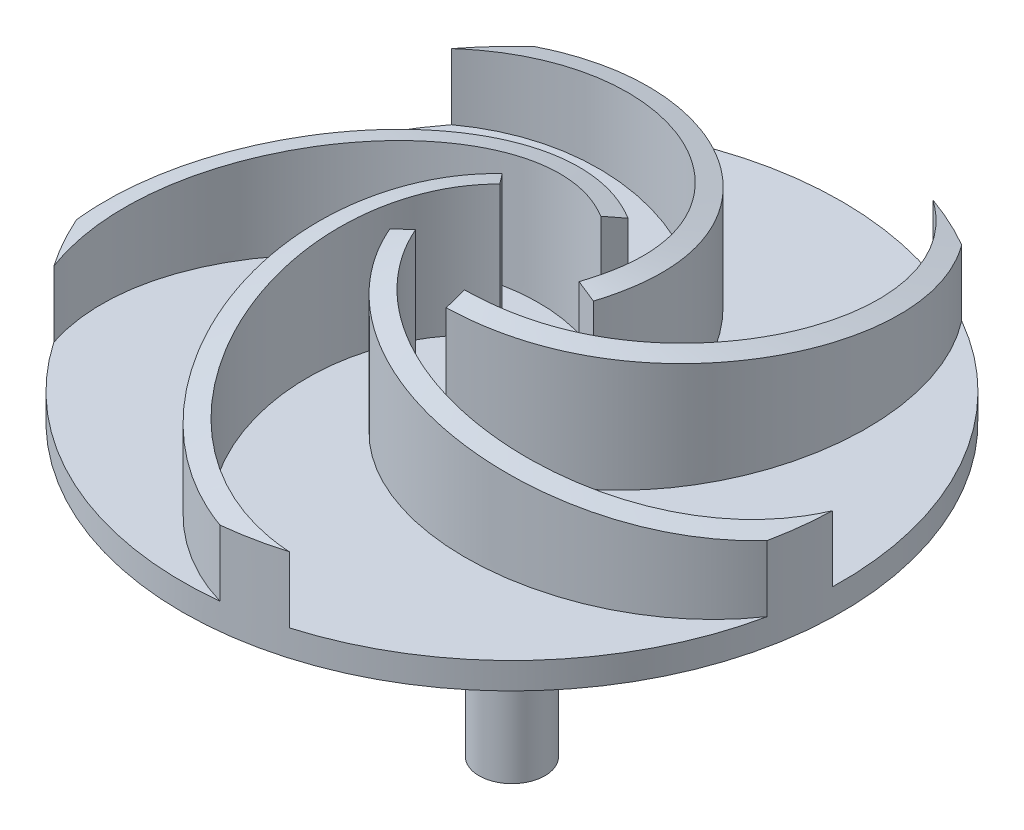
from build123d import *
from build123d.topology import SkipClean

# Parameters (mm, degrees)
SKETCH1_R           = 25
BOSS_EXTRUDE1_DEPTH = 2
BOSS_EXTRUDE3_DEPTH = 11
CIRPATTERN2_COUNT   = 5
SKETCH8_R           = 3
BOSS_EXTRUDE4_DEPTH = 22


with BuildPart() as part:
    # Sketch1 → Boss-Extrude1 (new body)
    with BuildSketch(Plane(origin=(0, 0, 0), x_dir=(1, 0, 0), z_dir=(0, 1, 0))):
        with Locations(Location((0, 0, 0), (0, 0, 270))):
            Circle(SKETCH1_R)
    extrude(amount=BOSS_EXTRUDE1_DEPTH)

    # Sketch6 → Boss-Extrude3 (add)
    with SkipClean():  # the faces are left unmerged after this step: merging them gives an invalid solid
        with BuildSketch(Plane(origin=(0, 2, 0), x_dir=(1, 0, 0), z_dir=(0, 1, 0))):
            with BuildLine():
                Line((-5.749328812, -3.514472379), (-4.357862857, -2.954273756))
                add(Edge.make_bspline(
                    [(24.990911261, -0.6740581), (24.887127665, -0.995867182), (24.628566718, -1.71005287), (23.985595049, -3.118765197), (22.927284176, -4.807175828), (21.362285482, -6.562232424), (18.938714489, -8.542099357), (15.390420708, -10.325722821), (10.688001964, -11.310980176), (5.945767318, -11.102441479), (2.299064528, -9.918635861), (-0.243718056, -8.363779173), (-1.919950701, -6.893472831), (-3.091637326, -5.406975724), (-3.870057013, -4.063909627), (-4.208200766, -3.326016377), (-4.357862857, -2.954273756)],
                    knots=[0.005993496, 0.005993496, 0.005993496, 0.005993496, 0.03125, 0.0625, 0.125, 0.1875, 0.25, 0.375, 0.5, 0.625, 0.75, 0.8125, 0.875, 0.9375, 0.96875, 1, 1, 1, 1], degree=3))
                ThreePointArc((24.990911261, -0.6740581), (24.830643284, -2.905022217), (24.471615475, -5.112732739))
                add(Edge.make_bspline(
                    [(24.471615475, -5.112732739), (24.344067288, -5.299138073), (23.703665176, -6.193036835), (22.402205392, -7.651941384), (19.740962464, -9.824635663), (15.884154507, -11.759601207), (10.813494683, -12.820990147), (5.68777112, -12.598238156), (1.692234731, -11.306666743), (-1.134460197, -9.57992313), (-3.013339021, -7.932747167), (-4.331263311, -6.260928308), (-5.204824167, -4.753175927), (-5.582097267, -3.929855409), (-5.749328812, -3.514472379)],
                    knots=[0.10889818, 0.10889818, 0.10889818, 0.10889818, 0.125, 0.1875, 0.25, 0.375, 0.5, 0.625, 0.75, 0.8125, 0.875, 0.9375, 0.96875, 1, 1, 1, 1], degree=3))
            make_face()
        boss_extrude3 = extrude(amount=BOSS_EXTRUDE3_DEPTH)

    # CirPattern2: Boss-Extrude3 ×5 about axis
    with SkipClean():  # the faces are left unmerged after this step: merging them gives an invalid solid
        cirpattern2_axis = Axis((0, 0, 0), (0, -1, 0))
        for i in range(1, CIRPATTERN2_COUNT):
            add(boss_extrude3.rotate(cirpattern2_axis, i * 360 / CIRPATTERN2_COUNT))

    # Sketch7 → Cut-Revolve7 (revolve, cut)
    with SkipClean():  # the faces are left unmerged after this step: merging them gives an invalid solid
        with BuildSketch(Plane(origin=(0, 0, 0), x_dir=(0, 0, -1), z_dir=(1, 0, 0)), mode=Mode.PRIVATE) as cut_revolve7_sk:
            Polygon((25, 7), (25, 13), (1, 13), align=None)
        revolve(cut_revolve7_sk.sketch.rotate(Axis((0, 0, 0), (0, 1, 0)), 340.454985394), axis=Axis((0, 0, 0), (0, 1, 0)), mode=Mode.SUBTRACT)

    # Sketch8 → Boss-Extrude4 (add)
    with SkipClean():  # the faces are left unmerged after this step: merging them gives an invalid solid
        with BuildSketch(Plane.XZ):
            with Locations(Location((0, 0, 0), (0, 0, 90))):
                Circle(SKETCH8_R)
        extrude(amount=BOSS_EXTRUDE4_DEPTH)

    # Sketch9 → Cut-Revolve8 (revolve, cut)
    with SkipClean():  # the faces are left unmerged after this step: merging them gives an invalid solid
        with BuildSketch(Plane.XY, mode=Mode.PRIVATE) as cut_revolve8_sk:
            Polygon((-3, -11), (-2.5, -12), (-2.5, -22), (-3, -22), align=None)
        revolve(cut_revolve8_sk.sketch.rotate(Axis((0, 0, 0), (0, -1, 0)), 270), axis=Axis((0, 0, 0), (0, -1, 0)), mode=Mode.SUBTRACT)


solid = part.part
